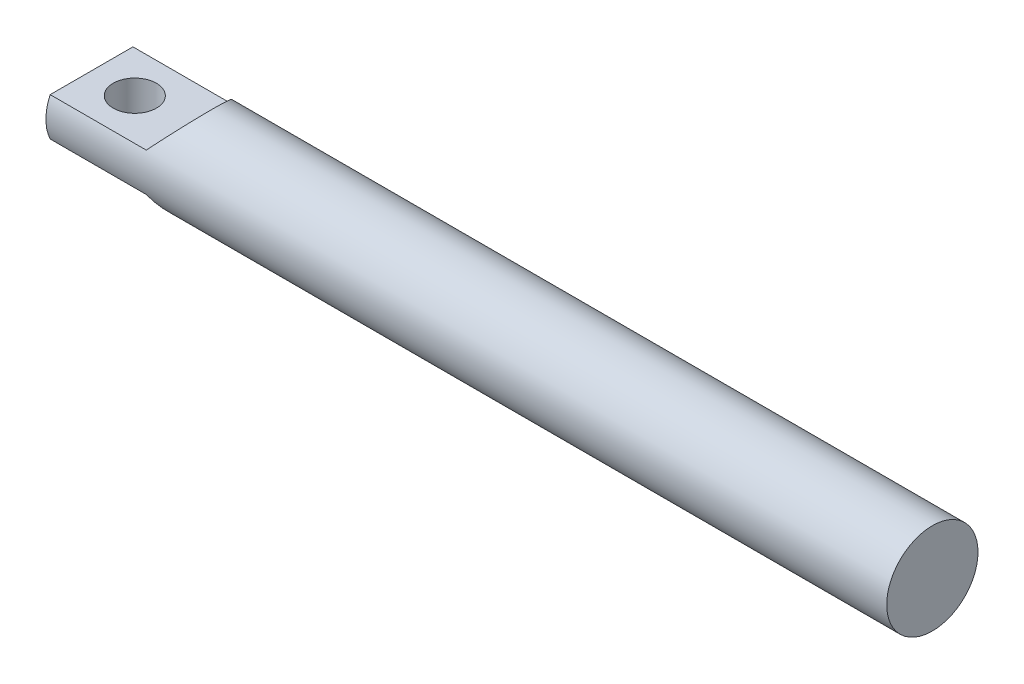
from build123d import *

# Parameters (mm, degrees)
SKETCH1_R               = 9.5
BOSS_EXTRUDE1_DEPTH     = 175
CUT_EXTRUDE1_DEPTH      = 176.514956628
CUT_EXTRUDE1_DEPTH_BACK = 176.514956628
SKETCH4_R               = 4.5
CUT_EXTRUDE2_DEPTH      = 176.776847167


with BuildPart() as part:
    # Sketch1 → Boss-Extrude1 (new body)
    with BuildSketch(Plane(origin=(0, 0, 0), x_dir=(0, 0, -1), z_dir=(1, 0, 0))):
        Circle(SKETCH1_R)
    extrude(amount=BOSS_EXTRUDE1_DEPTH)

    # Sketch3 → Cut-Extrude1 (cut, two sides: drawn at the far end of the back side and taken through both)
    with BuildSketch(Plane.XY.offset(-CUT_EXTRUDE1_DEPTH_BACK)):
        Polygon((20, 4), (0, 4), (0, 9.5), (25, 9.5), align=None)
        Polygon((20, -4), (0, -4), (0, -9.5), (25, -9.5), align=None)
    extrude(amount=CUT_EXTRUDE1_DEPTH + CUT_EXTRUDE1_DEPTH_BACK, mode=Mode.SUBTRACT)

    # Sketch4 → Cut-Extrude2 (cut, through all)
    with BuildSketch(Plane(origin=(0, 4, 0), x_dir=(1, 0, 0), z_dir=(0, 1, 0))):
        with Locations(Location((9, 0, 0), (0, 0, 270))):
            Circle(SKETCH4_R)
    extrude(amount=-CUT_EXTRUDE2_DEPTH, mode=Mode.SUBTRACT)


solid = part.part
